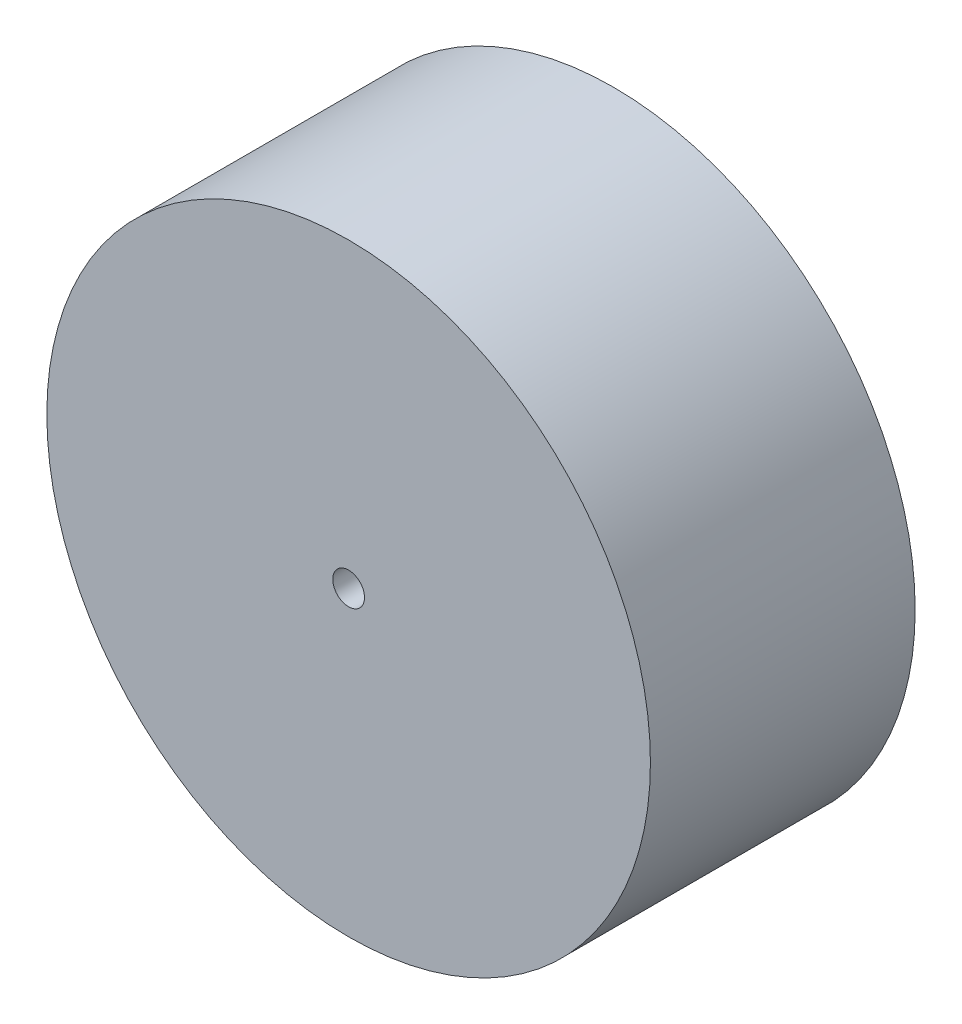
from build123d import *

# Parameters (mm, degrees)
SKETCH_1_R      = 28.5
SKETCH_1_R_2    = 1.5
EXTRUDE_1_DEPTH = 25


with BuildPart() as part:
    # Эскиз1 → Бобышка-Вытянуть1 (new body)
    with BuildSketch(Plane.XY):
        Circle(SKETCH_1_R)
        Circle(SKETCH_1_R_2, mode=Mode.SUBTRACT)
    extrude(amount=EXTRUDE_1_DEPTH)


solid = part.part
